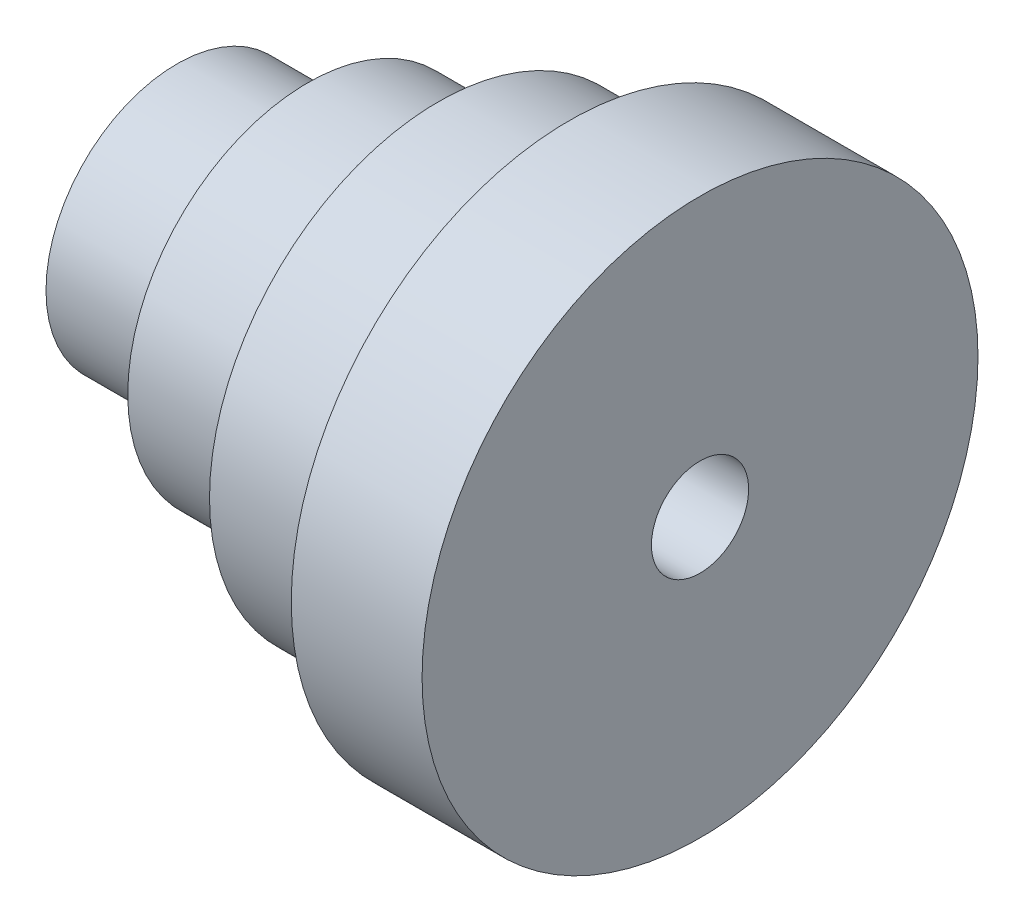
from build123d import *

# Parameters (mm, degrees)
SKETCH2_W          = 6
SKETCH2_H          = 10
CUT_EXTRUDE3_DEPTH = 100


with BuildPart() as part:
    # Sketch1 → Revolve2 (revolve)
    with BuildSketch(Plane.XY, mode=Mode.PRIVATE) as revolve2_sk:
        Polygon((-45.142857143, 22.857142857), (-176, 22.857142857), (-176, 14.867713129), (-16, 14.867713129), (-16, 22.857142857), align=None)
        Polygon((-136, 40), (-176, 40), (-176, 22.857142857), (-45.142857143, 22.857142857), (-45.142857143, 37.142857143), (-128, 37.142857143), (-128, 47), (-88, 47), (-88, 62), (-48, 62), (-48, 77), (-16, 77), (-16, 85), (-56, 85), (-56, 70), (-96, 70), (-96, 55), (-136, 55), align=None)
        Polygon((-45.142857143, 37.142857143), (-45.142857143, 22.857142857), (-16, 22.857142857), (-16, 77), (-48, 77), (-48, 62), (-88, 62), (-88, 47), (-128, 47), (-128, 37.142857143), align=None)
    revolve(revolve2_sk.sketch.rotate(Axis((-176, 0, 0), (1, 0, 0)), 90), axis=Axis((-176, 0, 0), (1, 0, 0)))

    # Sketch2 → Cut-Extrude3 (cut)
    with BuildSketch(Plane.ZY.offset(176)):
        with Locations((0, -14.867713129)):
            Rectangle(SKETCH2_W, SKETCH2_H)
    extrude(amount=-CUT_EXTRUDE3_DEPTH, mode=Mode.SUBTRACT)


solid = part.part
